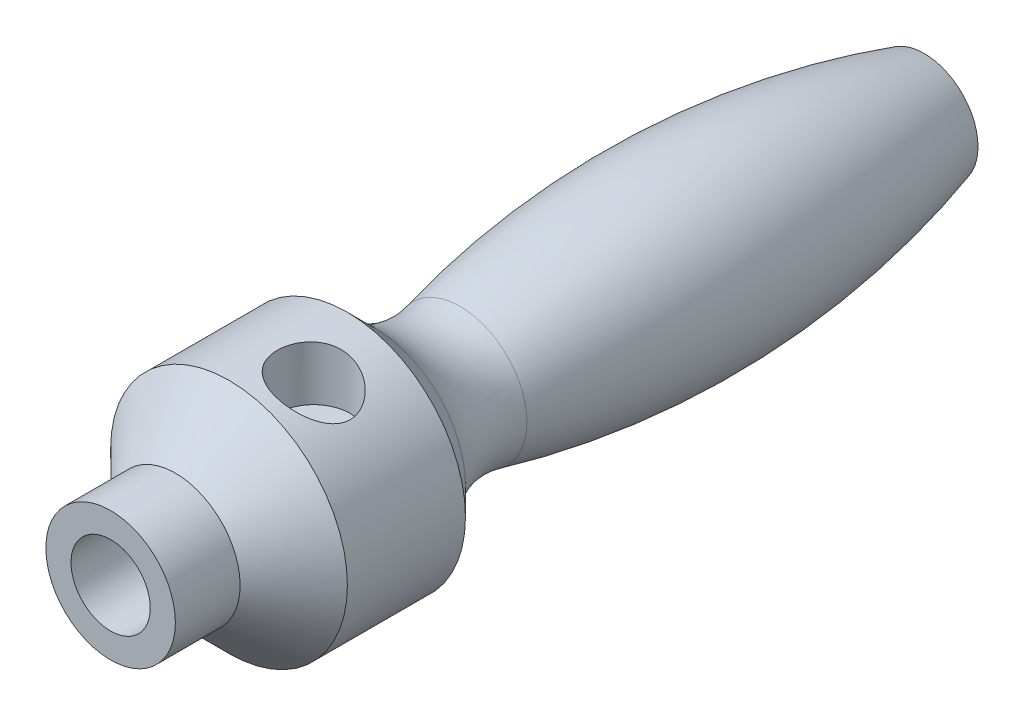
from build123d import *

# Parameters (mm, degrees)
CUT_EXTRUDE1_DEPTH      = 92.214667403
CUT_EXTRUDE1_DEPTH_BACK = 5
SKETCH2_R               = 1.5
CUT_EXTRUDE2_START      = 12
SKETCH3_R               = 4
CUT_EXTRUDE2_DEPTH      = 18


with BuildPart() as part:
    # Sketch1 → Revolve1 (revolve)
    with BuildSketch(Plane(origin=(0, 0, 0), x_dir=(1, 0, 0), z_dir=(0, 1, 0))):
        with BuildLine():
            Line((4.35, 0), (7.110769231, 0))
            Line((7.110769231, 0), (7.110769231, 7.110769231))
            Line((7.110769231, 7.110769231), (13, 13))
            Line((13, 13), (13, 25.966153846))
            Line((13, 25.966153846), (9.992154427, 28.973999419))
            ThreePointArc((9.992154427, 28.973999419), (7.439328335, 33.328329089), (7.33839208, 38.374805068))
            ThreePointArc((7.33839208, 38.374805068), (9.995816712, 63.953544784), (5.906153846, 89.342685943))
            Line((5.906153846, 89.342685943), (0, 89.342685943))
            Line((0, 89.342685943), (0, 24.5))
            Line((0, 24.5), (4.35, 24.5))
            Line((4.35, 24.5), (4.35, 0))
        make_face()
    revolve(axis=Axis((0, 0, 0), (0, 0, -1)))

    # Sketch2 → Cut-Extrude1 (cut, two sides: drawn at the far end of the back side and taken through both)
    with BuildSketch(Plane(origin=(0, 0, 0), x_dir=(1, 0, 0), z_dir=(0, 1, 0)).offset(-CUT_EXTRUDE1_DEPTH_BACK)):
        with Locations((3.8, 18.5)):
            Circle(SKETCH2_R)
    extrude(amount=CUT_EXTRUDE1_DEPTH + CUT_EXTRUDE1_DEPTH_BACK, mode=Mode.SUBTRACT)

    # Sketch3 → Cut-Extrude2 (cut)
    with BuildSketch(Plane(origin=(0, -5, 0), x_dir=(1, 0, 0), z_dir=(0, 1, 0)).offset(CUT_EXTRUDE2_START)):
        with Locations((3.8, 18.5)):
            Circle(SKETCH3_R)
    extrude(amount=CUT_EXTRUDE2_DEPTH, mode=Mode.SUBTRACT)


solid = part.part
